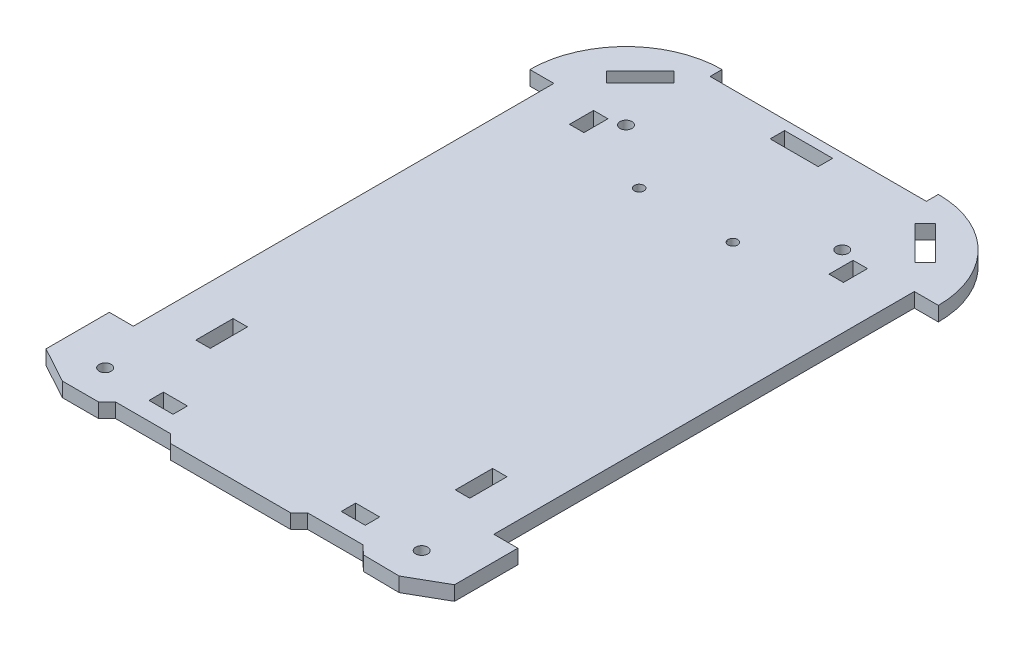
from build123d import *

# Parameters (mm, degrees)
SKETCH1_R           = 2.5
SKETCH1_R_2         = 2
SKETCH1_W           = 20
SKETCH1_H           = 6
SKETCH1_W_2         = 10
SKETCH1_W_3         = 6
SKETCH1_H_2         = 15.5
SKETCH1_H_3         = 10
BOSS_EXTRUDE1_DEPTH = 6


with BuildPart() as part:
    # Sketch1 → Boss-Extrude1 (new body)
    with BuildSketch(Plane(origin=(0, 0, 0), x_dir=(1, 0, 0), z_dir=(0, 1, 0))):
        with BuildLine():
            Line((-45, 125.078427477), (-45, 120.078427477))
            Line((-45, 120.078427477), (45, 120.078427477))
            Line((45, 120.078427477), (45, 125.078427477))
            ThreePointArc((45, 125.078427477), (73.284271247, 113.362698724), (85, 85.078427477))
            Line((85, 85.078427477), (75, 85.078427477))
            Line((75, 85.078427477), (75, -89.921572523))
            Line((75, -89.921572523), (85, -89.921572523))
            Line((85, -89.921572523), (85, -116.261318485))
            Line((85, -116.261318485), (70.323194947, -124.644732005))
            Line((70.323194947, -124.644732005), (55.323194947, -124.450192088))
            Line((55.323194947, -124.450192088), (51.474604803, -120.914658182))
            Line((51.474604803, -120.914658182), (28.549864753, -120.914658182))
            Line((28.549864753, -120.914658182), (25.014330847, -124.450192088))
            Line((25.014330847, -124.450192088), (-24.985669153, -124.450192088))
            Line((-24.985669153, -124.450192088), (-28.521203059, -120.914658182))
            Line((-28.521203059, -120.914658182), (-51.44594311, -120.914658182))
            Line((-51.44594311, -120.914658182), (-54.981477016, -124.450192088))
            Line((-54.981477016, -124.450192088), (-69.981477016, -124.450192088))
            Line((-69.981477016, -124.450192088), (-85, -116.261318485))
            Line((-85, -116.261318485), (-85, -89.921572523))
            Line((-85, -89.921572523), (-75, -89.921572523))
            Line((-75, -89.921572523), (-75, 85.078427477))
            Line((-75, 85.078427477), (-85, 85.078427477))
            ThreePointArc((-85, 85.078427477), (-73.284271247, 113.362698724), (-45, 125.078427477))
        make_face()
        with Locations(Location((-45, 85.078427477, 0), (0, 0, 270))):
            Circle(SKETCH1_R, mode=Mode.SUBTRACT)
        with Locations(Location((45, 85.078427477, 0), (0, 0, 270))):
            Circle(SKETCH1_R, mode=Mode.SUBTRACT)
        with Locations(Location((-65.857864376, -110.779436899, 0), (0, 0, 270))):
            Circle(SKETCH1_R, mode=Mode.SUBTRACT)
        with Locations(Location((65.857864376, -110.779436899, 0), (0, 0, 90))):
            Circle(SKETCH1_R, mode=Mode.SUBTRACT)
        with Locations(Location((19.5, 65.078427477, 0), (0, 0, 270))):
            Circle(SKETCH1_R_2, mode=Mode.SUBTRACT)
        with Locations(Location((-19.5, 65.078427477, 0), (0, 0, 270))):
            Circle(SKETCH1_R_2, mode=Mode.SUBTRACT)
        Polygon((50.571600169, 109.810660524), (54.814240856, 114.053301211), (68.95637648, 99.911165587), (64.713735792, 95.6685249), align=None, mode=Mode.SUBTRACT)
        with Locations((0, 113.078427477)):
            Rectangle(SKETCH1_W, SKETCH1_H, mode=Mode.SUBTRACT)
        Polygon((-50.11039508, 110.271865613), (-64.252530704, 96.129729989), (-68.495171391, 100.372370676), (-54.353035767, 114.5145063), align=None, mode=Mode.SUBTRACT)
        with Locations((-39.983573085, -110.414658182)):
            Rectangle(SKETCH1_W_2, SKETCH1_H, mode=Mode.SUBTRACT)
        with Locations((40.012234778, -110.414658182)):
            Rectangle(SKETCH1_W_2, SKETCH1_H, mode=Mode.SUBTRACT)
        with Locations((54, -74.171572523)):
            Rectangle(SKETCH1_W_3, SKETCH1_H_2, mode=Mode.SUBTRACT)
        with Locations((-54, -74.171572523)):
            Rectangle(SKETCH1_W_3, SKETCH1_H_2, mode=Mode.SUBTRACT)
        with Locations((54, 78.578427477)):
            Rectangle(SKETCH1_W_3, SKETCH1_H_3, mode=Mode.SUBTRACT)
        with Locations((-54, 78.578427477)):
            Rectangle(SKETCH1_W_3, SKETCH1_H_3, mode=Mode.SUBTRACT)
    extrude(amount=BOSS_EXTRUDE1_DEPTH)


solid = part.part
